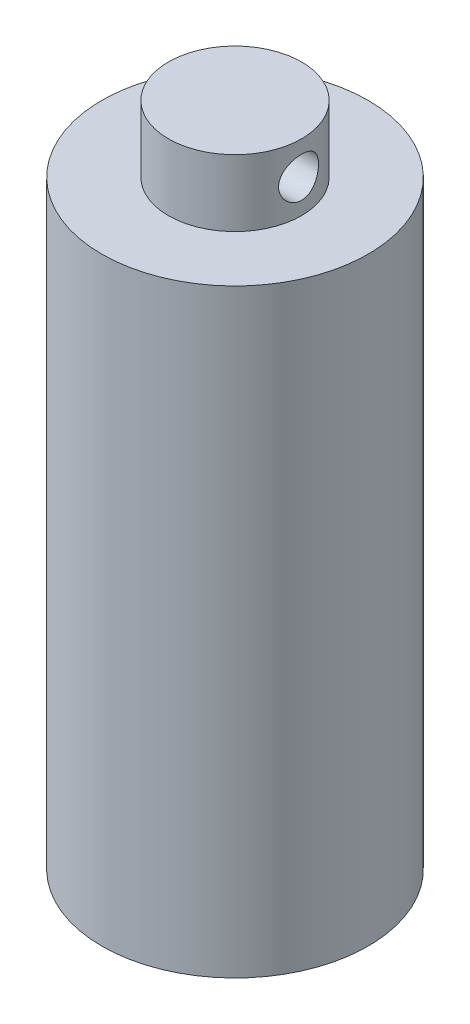
from build123d import *

# Parameters (mm, degrees)
SKETCH1_R               = 2.54
BOSS_EXTRUDE1_DEPTH     = 11.43
SKETCH2_R               = 1.27
BOSS_EXTRUDE2_DEPTH     = 1.27
CUT_EXTRUDE1_DEPTH      = 14.198227154
CUT_EXTRUDE1_DEPTH_BACK = 14.198227154
SKETCH3_R               = 0.381
SCALE1_SCALE            = 1.5


with BuildPart() as part:
    # Sketch1 → Boss-Extrude1 (new body)
    with BuildSketch(Plane(origin=(0, 0, 0), x_dir=(1, 0, 0), z_dir=(0, 1, 0))):
        with Locations(Location((0, 0, 0), (0, 0, 270))):
            Circle(SKETCH1_R)
    extrude(amount=BOSS_EXTRUDE1_DEPTH)

    # Sketch2 → Boss-Extrude2 (add)
    with BuildSketch(Plane(origin=(0, 11.43, 0), x_dir=(1, 0, 0), z_dir=(0, 1, 0))):
        with Locations(Location((0, 0, 0), (0, 0, 270))):
            Circle(SKETCH2_R)
    extrude(amount=BOSS_EXTRUDE2_DEPTH)

    # Sketch3 → Cut-Extrude1 (cut, two sides: drawn at the far end of the back side and taken through both)
    with BuildSketch(Plane(origin=(0, 0, 0), x_dir=(0, 0, -1), z_dir=(1, 0, 0)).offset(-CUT_EXTRUDE1_DEPTH_BACK)):
        with Locations((0, 12.065)):
            Circle(SKETCH3_R)
    extrude(amount=CUT_EXTRUDE1_DEPTH + CUT_EXTRUDE1_DEPTH_BACK, mode=Mode.SUBTRACT)


with BuildPart() as part_1:
    # Scale1: scaled about (0, 5.856765052, -1.11e-07)
    add(part.part.scale(SCALE1_SCALE).moved(Location((0, -2.928382526, 5.6e-08))))


solid = part_1.part
